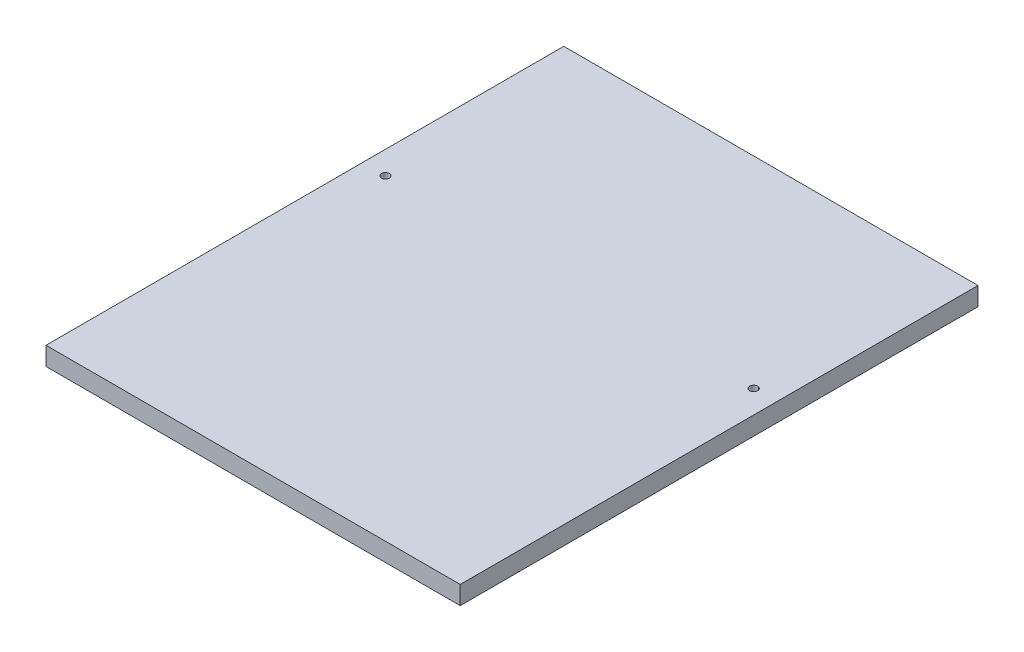
from build123d import *

# Parameters (mm, degrees)
SKETCH_2_W      = 360
SKETCH_2_H      = 450
SKETCH_2_R      = 3.5
EXTRUDE_1_DEPTH = 16


with BuildPart() as part:
    # Эскиз2 → Бобышка-Вытянуть1 (new body)
    with BuildSketch(Plane(origin=(0, 0, 0), x_dir=(1, 0, 0), z_dir=(0, 1, 0))):
        with Locations((180, 225)):
            Rectangle(SKETCH_2_W, SKETCH_2_H)
        with Locations(Location((20, 275, 0), (0, 0, 270))):
            Circle(SKETCH_2_R, mode=Mode.SUBTRACT)
        with Locations(Location((340, 275, 0), (0, 0, 270))):
            Circle(SKETCH_2_R, mode=Mode.SUBTRACT)
    extrude(amount=EXTRUDE_1_DEPTH)


solid = part.part
